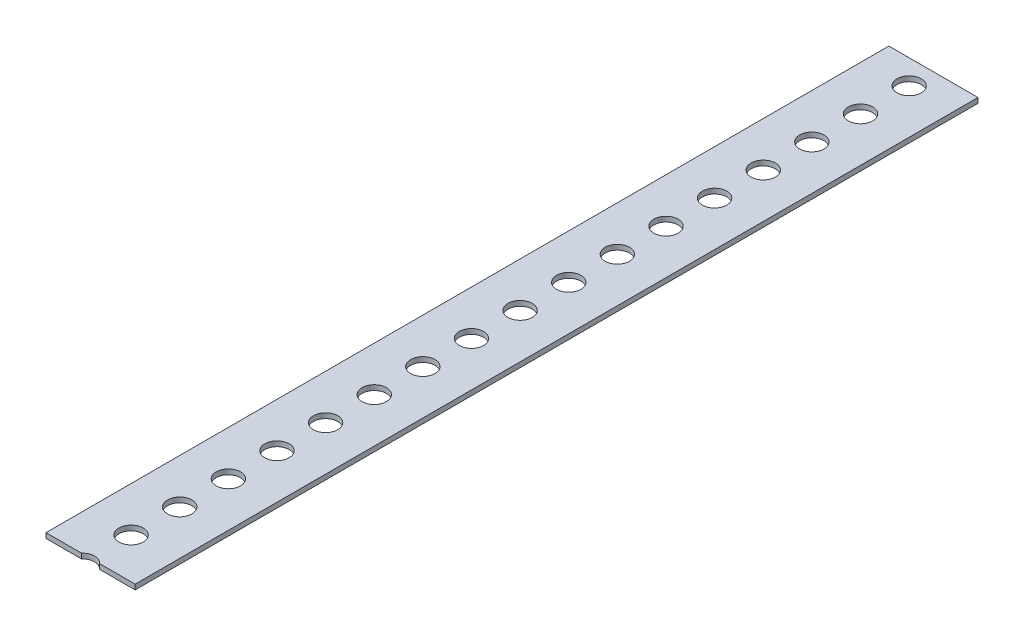
from build123d import *

# Parameters (mm, degrees)
BOSS_EXTRUDE1_DEPTH      = 0.99187
BOSS_EXTRUDE1_DEPTH_BACK = 0.99187
SKETCH3_W                = 34.925
SKETCH3_H                = 914.4
CUT_EXTRUDE1_REACH       = 459.538
SKETCH4_R                = 4.7625
LPATTERN1_COUNT          = 53
LPATTERN1_PITCH          = 19.05
SKETCH5_W                = 34.925
SKETCH5_H                = 1.98374
CUT_EXTRUDE2_DEPTH       = 584.2


with BuildPart() as part:
    # Sketch3 → Boss-Extrude1 (new, two sides: drawn at the far end of the back side and taken through both)
    with BuildSketch(Plane(origin=(0, 0, 0), x_dir=(1, 0, 0), z_dir=(0, 1, 0)).offset(-BOSS_EXTRUDE1_DEPTH_BACK)):
        Rectangle(SKETCH3_W, SKETCH3_H)
    extrude(amount=BOSS_EXTRUDE1_DEPTH + BOSS_EXTRUDE1_DEPTH_BACK)

    # Sketch4 → Cut-Extrude1 (cut, up to next)
    with BuildSketch(Plane(origin=(0, 0.99187, 0), x_dir=(1, 0, 0), z_dir=(0, 1, 0)), mode=Mode.PRIVATE) as cut_extrude1_sk1:
        with Locations(Location((0, -447.675, 0), (0, 0, 270))):
            Circle(SKETCH4_R)
    cut_extrude1_tool1 = extrude(cut_extrude1_sk1.sketch, amount=-CUT_EXTRUDE1_REACH, mode=Mode.PRIVATE) & part.part
    cut_extrude1 = cut_extrude1_tool1.solids().sort_by_distance((0, 0.99187, 447.675))[0]
    add(cut_extrude1, mode=Mode.SUBTRACT)

    # LPattern1: Cut-Extrude1 ×53
    with Locations(*[(0, 0, -i * LPATTERN1_PITCH) for i in range(1, LPATTERN1_COUNT)]):
        add(cut_extrude1, mode=Mode.SUBTRACT)

    # Sketch5 → Cut-Extrude2 (cut)
    with BuildSketch(Plane.XY.offset(457.2)):
        Rectangle(SKETCH5_W, SKETCH5_H)
    extrude(amount=-CUT_EXTRUDE2_DEPTH, mode=Mode.SUBTRACT)


solid = part.part
